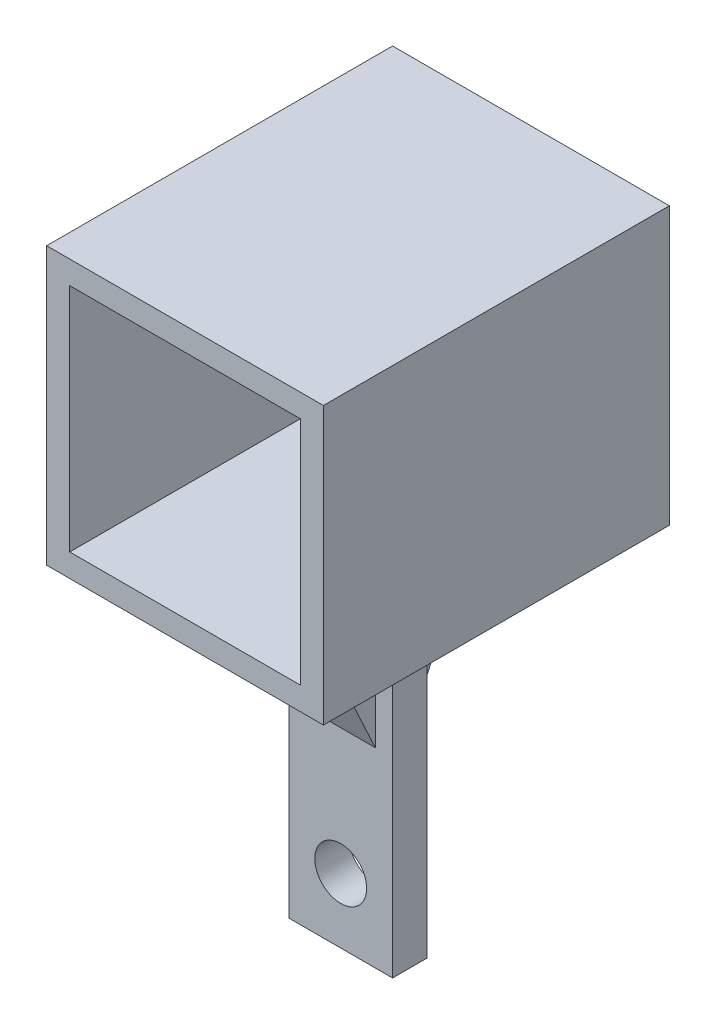
from build123d import *

# Parameters (mm, degrees)
CROQUIS1_W               = 9
CROQUIS1_H               = 31.5
CROQUIS1_R               = 2.25
SALIENTE_EXTRUIR1_DEPTH  = 1.5
CROQUIS11_W              = 24
CROQUIS11_H              = 24
CROQUIS11_W_2            = 20
CROQUIS11_H_2            = 20
SALIENTE_EXTRUIR8_DEPTH  = 15
SALIENTE_EXTRUIR11_DEPTH = 3


with BuildPart() as part:
    # Croquis1 → Saliente-Extruir1 (new, symmetric)
    with BuildSketch(Plane.XY):
        with Locations((0, 10.15)):
            Rectangle(CROQUIS1_W, CROQUIS1_H)
        Circle(CROQUIS1_R, mode=Mode.SUBTRACT)
    extrude(amount=SALIENTE_EXTRUIR1_DEPTH, both=True)

    # Croquis11 → Saliente-Extruir8 (add, symmetric)
    with BuildSketch(Plane.XY):
        with Locations((0, 35.9)):
            Rectangle(CROQUIS11_W, CROQUIS11_H)
        with Locations((0, 35.9)):
            Rectangle(CROQUIS11_W_2, CROQUIS11_H_2, mode=Mode.SUBTRACT)
    extrude(amount=SALIENTE_EXTRUIR8_DEPTH, both=True)

    # Croquis13 → Saliente-Extruir11 (add, symmetric)
    with BuildSketch(Plane(origin=(0, 0, 0), x_dir=(0, 0, -1), z_dir=(1, 0, 0))):
        Polygon((1.5, 10.95), (1.5, 23.9), (7.5, 23.9), align=None)
        Polygon((-7.5, 23.9), (-1.5, 10.95), (-1.5, 23.9), align=None)
    extrude(amount=SALIENTE_EXTRUIR11_DEPTH, both=True)


solid = part.part
